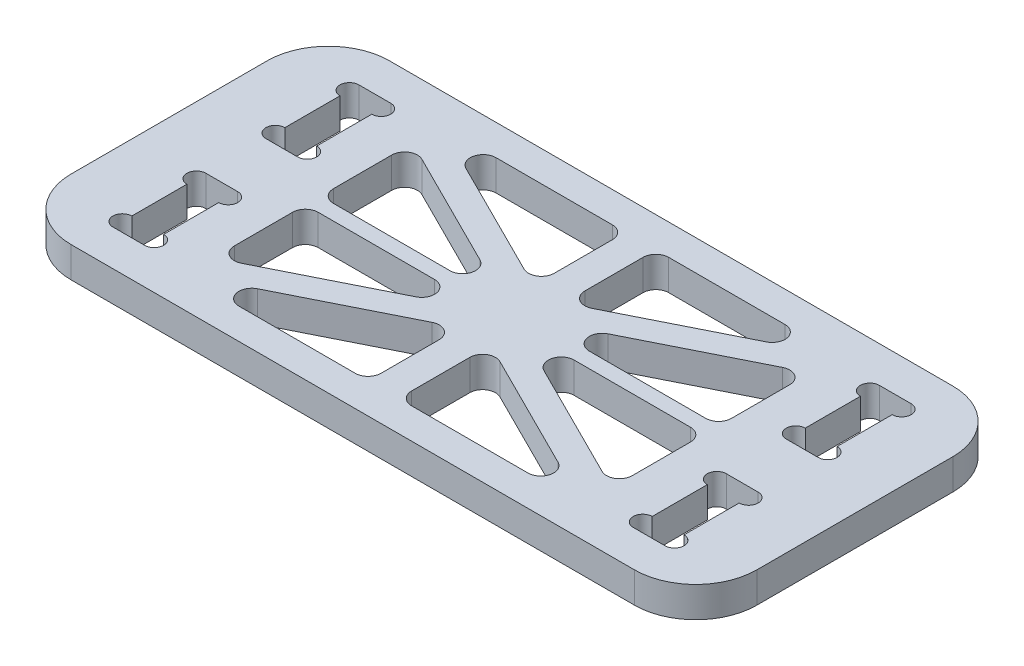
from build123d import *

# Parameters (mm, degrees)
SKETCH_1_W          = 112
SKETCH_1_H          = 52
SKETCH_1_W_2        = 5
SKETCH_1_H_2        = 15
EXTRUDE_1_DEPTH     = 5
MOVE_FACE_1_BY      = 0.1
MOVE_FACE_1_2_BY    = 0.1
MOVE_FACE_1_3_BY    = 0.1
MOVE_FACE_1_4_BY    = 0.1
MOVE_FACE_1_5_BY    = 0.1
MOVE_FACE_1_6_BY    = 0.1
MOVE_FACE_1_7_BY    = 0.1
MOVE_FACE_1_8_BY    = 0.1
MOVE_FACE_1_9_BY    = 0.1
MOVE_FACE_1_10_BY   = 0.1
MOVE_FACE_1_11_BY   = 0.1
MOVE_FACE_1_12_BY   = 0.1
MOVE_FACE_1_13_BY   = 0.1
MOVE_FACE_1_14_BY   = 0.1
MOVE_FACE_1_15_BY   = 0.1
MOVE_FACE_1_16_BY   = 0.1
SKETCH_2_R          = 1.55
CUT_EXTRUDE_1_DEPTH = 5
CUT_EXTRUDE_2_DEPTH = 5
FILLET_1_R          = 2.1
FILLET_2_R          = 10


with BuildPart() as part:
    # 草图1 → 凸台-拉伸1 (new body)
    with BuildSketch(Plane(origin=(0, 0, 0), x_dir=(1, 0, 0), z_dir=(0, 1, 0))):
        Rectangle(SKETCH_1_W, SKETCH_1_H)
        with Locations((42.5, -12.5)):
            Rectangle(SKETCH_1_W_2, SKETCH_1_H_2, mode=Mode.SUBTRACT)
        with Locations((42.5, 12.5)):
            Rectangle(SKETCH_1_W_2, SKETCH_1_H_2, mode=Mode.SUBTRACT)
        with Locations((-42.5, -12.5)):
            Rectangle(SKETCH_1_W_2, SKETCH_1_H_2, mode=Mode.SUBTRACT)
        with Locations((-42.5, 12.5)):
            Rectangle(SKETCH_1_W_2, SKETCH_1_H_2, mode=Mode.SUBTRACT)
    extrude(amount=EXTRUDE_1_DEPTH)

    # Move Face 1: a face moved inward by 0.1
    extrude(part.faces().sort_by_distance((-45, 2.5, -12.5))[0], amount=MOVE_FACE_1_BY, dir=(-1, 0, 0), mode=Mode.SUBTRACT)

    # Move Face 1 2: a face moved inward by 0.1
    extrude(part.faces().sort_by_distance((-42.5, 2.5, -20))[0], amount=MOVE_FACE_1_2_BY, dir=(0, 0, -1), mode=Mode.SUBTRACT)

    # Move Face 1 3: a face moved inward by 0.1
    extrude(part.faces().sort_by_distance((-45, 2.5, 12.5))[0], amount=MOVE_FACE_1_3_BY, dir=(-1, 0, 0), mode=Mode.SUBTRACT)

    # Move Face 1 4: a face moved inward by 0.1
    extrude(part.faces().sort_by_distance((-42.5, 2.5, 5))[0], amount=MOVE_FACE_1_4_BY, dir=(0, 0, -1), mode=Mode.SUBTRACT)

    # Move Face 1 5: a face moved inward by 0.1
    extrude(part.faces().sort_by_distance((-42.5, 2.5, 20))[0], amount=MOVE_FACE_1_5_BY, dir=(0, 0, 1), mode=Mode.SUBTRACT)

    # Move Face 1 6: a face moved inward by 0.1
    extrude(part.faces().sort_by_distance((-40, 2.5, 12.5))[0], amount=MOVE_FACE_1_6_BY, dir=(1, 0, 0), mode=Mode.SUBTRACT)

    # Move Face 1 7: a face moved inward by 0.1
    extrude(part.faces().sort_by_distance((-42.5, 2.5, -5))[0], amount=MOVE_FACE_1_7_BY, dir=(0, 0, 1), mode=Mode.SUBTRACT)

    # Move Face 1 8: a face moved inward by 0.1
    extrude(part.faces().sort_by_distance((-40, 2.5, -12.5))[0], amount=MOVE_FACE_1_8_BY, dir=(1, 0, 0), mode=Mode.SUBTRACT)

    # Move Face 1 9: a face moved inward by 0.1
    extrude(part.faces().sort_by_distance((42.5, 2.5, 20))[0], amount=MOVE_FACE_1_9_BY, dir=(0, 0, 1), mode=Mode.SUBTRACT)

    # Move Face 1 10: a face moved inward by 0.1
    extrude(part.faces().sort_by_distance((40, 2.5, 12.5))[0], amount=MOVE_FACE_1_10_BY, dir=(-1, 0, 0), mode=Mode.SUBTRACT)

    # Move Face 1 11: a face moved inward by 0.1
    extrude(part.faces().sort_by_distance((45, 2.5, 12.5))[0], amount=MOVE_FACE_1_11_BY, dir=(1, 0, 0), mode=Mode.SUBTRACT)

    # Move Face 1 12: a face moved inward by 0.1
    extrude(part.faces().sort_by_distance((42.5, 2.5, 5))[0], amount=MOVE_FACE_1_12_BY, dir=(0, 0, -1), mode=Mode.SUBTRACT)

    # Move Face 1 13: a face moved inward by 0.1
    extrude(part.faces().sort_by_distance((42.5, 2.5, -5))[0], amount=MOVE_FACE_1_13_BY, dir=(0, 0, 1), mode=Mode.SUBTRACT)

    # Move Face 1 14: a face moved inward by 0.1
    extrude(part.faces().sort_by_distance((40, 2.5, -12.5))[0], amount=MOVE_FACE_1_14_BY, dir=(-1, 0, 0), mode=Mode.SUBTRACT)

    # Move Face 1 15: a face moved inward by 0.1
    extrude(part.faces().sort_by_distance((42.5, 2.5, -20))[0], amount=MOVE_FACE_1_15_BY, dir=(0, 0, -1), mode=Mode.SUBTRACT)

    # Move Face 1 16: a face moved inward by 0.1
    extrude(part.faces().sort_by_distance((45, 2.5, -12.5))[0], amount=MOVE_FACE_1_16_BY, dir=(1, 0, 0), mode=Mode.SUBTRACT)

    # 草图2 → 切除-拉伸1 (cut)
    with BuildSketch(Plane(origin=(0, 5, 0), x_dir=(1, 0, 0), z_dir=(0, 1, 0))):
        with Locations((45.1, 18.55)):
            Circle(SKETCH_2_R)
        with Locations((45.1, 6.45)):
            Circle(SKETCH_2_R)
        with Locations((45.1, -6.45)):
            Circle(SKETCH_2_R)
        with Locations((45.1, -18.55)):
            Circle(SKETCH_2_R)
        with Locations((39.9, -18.55)):
            Circle(SKETCH_2_R)
        with Locations((39.9, -6.45)):
            Circle(SKETCH_2_R)
        with Locations((39.9, 6.45)):
            Circle(SKETCH_2_R)
        with Locations((39.9, 18.55)):
            Circle(SKETCH_2_R)
        with Locations((-39.9, 18.55)):
            Circle(SKETCH_2_R)
        with Locations((-39.9, 6.45)):
            Circle(SKETCH_2_R)
        with Locations((-39.9, -6.45)):
            Circle(SKETCH_2_R)
        with Locations((-39.9, -18.55)):
            Circle(SKETCH_2_R)
        with Locations((-45.1, -18.55)):
            Circle(SKETCH_2_R)
        with Locations((-45.1, -6.45)):
            Circle(SKETCH_2_R)
        with Locations((-45.1, 6.45)):
            Circle(SKETCH_2_R)
        with Locations((-45.1, 18.55)):
            Circle(SKETCH_2_R)
    extrude(amount=-CUT_EXTRUDE_1_DEPTH, mode=Mode.SUBTRACT)

    # 草图3 → 切除-拉伸2 (cut)
    with BuildSketch(Plane(origin=(0, 5, 0), x_dir=(1, 0, 0), z_dir=(0, 1, 0))):
        Polygon((2.5, 21), (32.5, 21), (2.5, 6), align=None)
        Polygon((32.5, 16.25), (2.5, 1.25), (32.5, 1.25), align=None)
        Polygon((-2.5, 1.25), (-32.5, 1.25), (-32.5, 16.25), align=None)
        Polygon((-32.5, 21), (-2.5, 6), (-2.5, 21), align=None)
        Polygon((2.5, -1.25), (32.5, -1.25), (32.5, -16.25), align=None)
        Polygon((32.5, -21), (2.5, -6), (2.5, -21), align=None)
        Polygon((-32.5, -1.25), (-32.5, -16.25), (-2.5, -1.25), align=None)
        Polygon((-2.5, -21), (-32.5, -21), (-2.5, -6), align=None)
    extrude(amount=-CUT_EXTRUDE_2_DEPTH, mode=Mode.SUBTRACT)

    # 圆角1
    fillet_1_edges = [part.edges().sort_by_distance(p)[0] for p in [
        (32.5, 2.5, 16.25),
        (2.5, 2.5, 1.25),
        (32.5, 2.5, 1.25),
        (-32.5, 2.5, -21),
        (-2.5, 2.5, -21),
        (-2.5, 2.5, -6),
        (-32.5, 2.5, -16.25),
        (-2.5, 2.5, -1.25),
        (-32.5, 2.5, -1.25),
        (32.5, 2.5, -16.25),
        (32.5, 2.5, -1.25),
        (2.5, 2.5, -1.25),
        (-2.5, 2.5, 6),
        (-2.5, 2.5, 21),
        (-32.5, 2.5, 21),
        (-32.5, 2.5, 1.25),
        (-2.5, 2.5, 1.25),
        (-32.5, 2.5, 16.25),
        (32.5, 2.5, 21),
        (2.5, 2.5, 21),
        (2.5, 2.5, 6),
        (2.5, 2.5, -6),
        (2.5, 2.5, -21),
        (32.5, 2.5, -21),
    ]]
    fillet(fillet_1_edges, radius=FILLET_1_R)

    # 圆角2
    fillet_2_edges = [part.edges().sort_by_distance(p)[0] for p in [
        (-56, 2.5, -26),
        (56, 2.5, -26),
        (56, 2.5, 26),
        (-56, 2.5, 26),
    ]]
    fillet(fillet_2_edges, radius=FILLET_2_R)


solid = part.part
